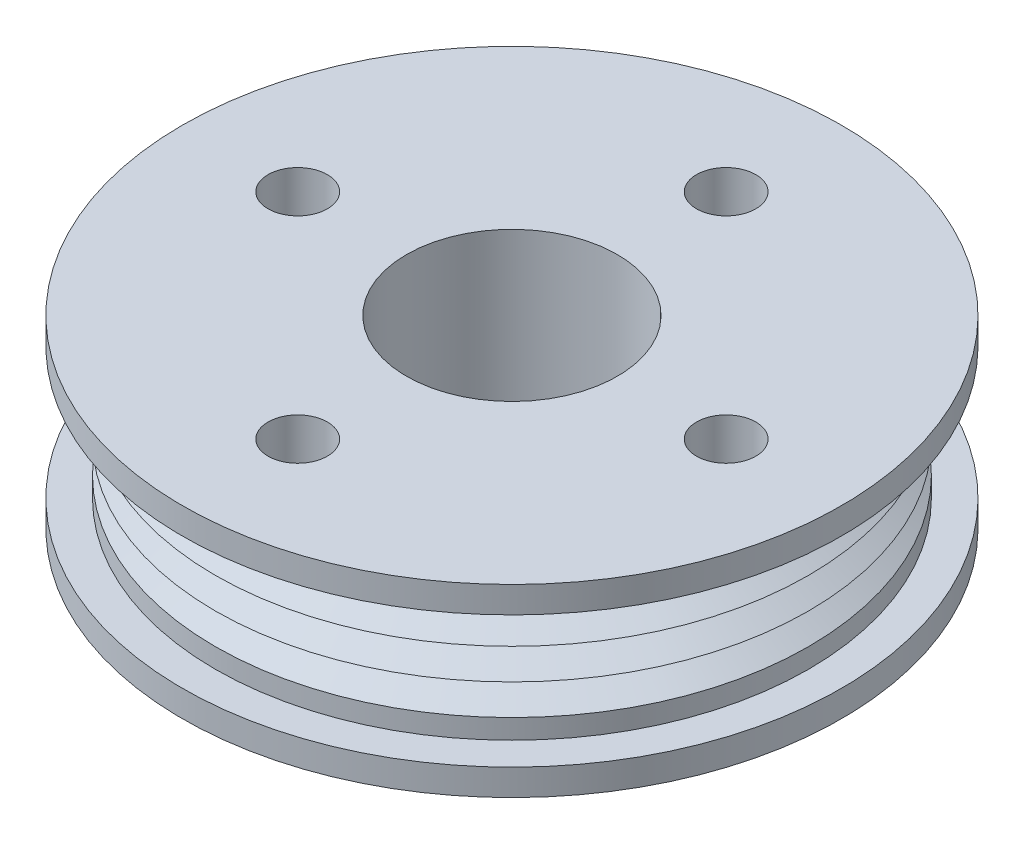
from build123d import *

# Parameters (mm, degrees)
ESBO_O2_R             = 2.25
ESBO_O2_R_2           = 8
CORTE_EXTRUS_O1_DEPTH = 14


with BuildPart() as part:
    # Esboço1 → Revolução1 (revolve)
    with BuildSketch(Plane.XY):
        Polygon((0, 7), (0, -7), (-25, -7), (-25, -5), (-22.5, -5), (-22.5, -3.51), (-20.7, -2.34), (-22.5, -1.17), (-20.7, 0), (-22.5, 1.17), (-20.7, 2.34), (-22.5, 3.51), (-22.5, 5), (-25, 5), (-25, 7), align=None)
    revolve(axis=Axis((0, 7, 0), (0, -1, 0)))

    # Esboço2 → Corte-extrusão1 (cut)
    with BuildSketch(Plane(origin=(0, 7, 0), x_dir=(1, 0, 0), z_dir=(0, 1, 0))):
        with Locations(Location((16.25, 0, 0), (0, 0, 180))):
            Circle(ESBO_O2_R)
        with Locations(Location((0, -16.25, 0), (0, 0, 180))):
            Circle(ESBO_O2_R)
        with Locations(Location((-16.25, 0, 0), (0, 0, 180))):
            Circle(ESBO_O2_R)
        with Locations(Location((0, 16.25, 0), (0, 0, 180))):
            Circle(ESBO_O2_R)
        with Locations(Location((0, 0, 0), (0, 0, 180))):
            Circle(ESBO_O2_R_2)
    extrude(amount=-CORTE_EXTRUS_O1_DEPTH, mode=Mode.SUBTRACT)


solid = part.part
